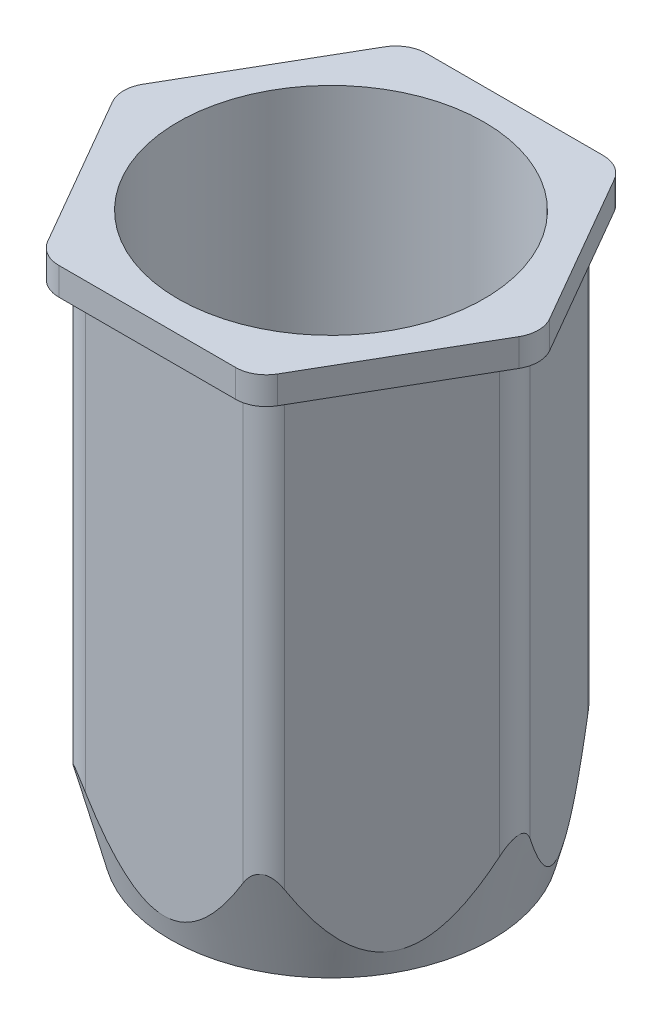
from build123d import *

# Parameters (mm, degrees)
BOSS_EXTRUDE1_DEPTH   = 0.9
BOSS_EXTRUDE2_DEPTH   = 17.1
FILLET2_R             = 1
FILLET3_R             = 0.2
SKETCH4_R             = 5
CUT_EXTRUDE1_DEPTH    = 8
M8_TAPPED_HOLE1_D     = 6.8
M8_TAPPED_HOLE1_DEPTH = 22.25
M8_TAPPED_HOLE1_TIP   = 2.042926105
CHAMFER1_SIZE         = 0.5


with BuildPart() as part:
    # Sketch1 → Boss-Extrude1 (new body)
    with BuildSketch(Plane(origin=(0, 0, 0), x_dir=(1, 0, 0), z_dir=(0, 1, 0))):
        Polygon((6.92820323, 0), (3.464101615, 6), (-3.464101615, 6), (-6.92820323, 0), (-3.464101615, -6), (3.464101615, -6), align=None)
    extrude(amount=-BOSS_EXTRUDE1_DEPTH)

    # Sketch2 → Boss-Extrude2 (add)
    with BuildSketch(Plane.XZ.offset(0.9)):
        Polygon((-6.293117934, 0), (-3.146558967, -5.45), (3.146558967, -5.45), (6.293117934, 0), (3.146558967, 5.45), (-3.146558967, 5.45), align=None)
    extrude(amount=BOSS_EXTRUDE2_DEPTH)

    # Sketch3 → Cut-Revolve1 (revolve, cut)
    with BuildSketch(Plane.XY, mode=Mode.PRIVATE) as cut_revolve1_sk:
        Polygon((-6.293117934, -18), (-5.25, -18), (-6.293117934, -14), align=None)
    revolve(cut_revolve1_sk.sketch.rotate(Axis((0, 0, 0), (0, -1, 0)), 270), axis=Axis((0, 0, 0), (0, -1, 0)), mode=Mode.SUBTRACT)

    # Fillet2
    fillet2_edges = [part.edges().sort_by_distance(p)[0] for p in [
        (-6.92820323, -0.45, 0),
        (-6.293117934, -7.45, 0),
        (-3.146558967, -7.45, -5.45),
        (-3.464101615, -0.45, -6),
        (3.146558967, -7.45, -5.45),
        (3.464101615, -0.45, -6),
        (6.293117934, -7.45, 0),
        (6.92820323, -0.45, 0),
        (3.146558967, -7.45, 5.45),
        (3.464101615, -0.45, 6),
        (-3.146558967, -7.45, 5.45),
        (-3.464101615, -0.45, 6),
    ]]
    fillet(fillet2_edges, radius=FILLET2_R)

    # Fillet3
    fillet3_edges = [part.edges().sort_by_distance(p)[0] for p in [
        (-3.069208698, -0.9, -5.316025404),
        (3.069208698, -0.9, -5.316025404),
        (6.138417396, -0.9, 0),
        (3.069208698, -0.9, 5.316025404),
        (-3.069208698, -0.9, 5.316025404),
        (-6.138417396, -0.9, 0),
        (0, -0.9, -5.45),
        (-4.719838451, -0.9, -2.725),
        (-4.719838451, -0.9, 2.725),
        (0, -0.9, 5.45),
        (4.719838451, -0.9, 2.725),
        (4.719838451, -0.9, -2.725),
    ]]
    fillet(fillet3_edges, radius=FILLET3_R)

    # Sketch4 → Cut-Extrude1 (cut)
    with BuildSketch(Plane(origin=(0, 0, 0), x_dir=(1, 0, 0), z_dir=(0, 1, 0))):
        with Locations(Location((0, 0, 0), (0, 0, 270))):
            Circle(SKETCH4_R)
    extrude(amount=-CUT_EXTRUDE1_DEPTH, mode=Mode.SUBTRACT)

    # M8 Tapped Hole1
    with Locations(Plane(origin=(0, -8, 0), x_dir=(1, 0, 0), z_dir=(0, 1, 0))):
        with Locations((0, 0)):
            Hole(M8_TAPPED_HOLE1_D / 2, depth=M8_TAPPED_HOLE1_DEPTH)
            with Locations((0, 0, -(M8_TAPPED_HOLE1_DEPTH + M8_TAPPED_HOLE1_TIP / 2))):  # 118° drill point
                Cone(0, M8_TAPPED_HOLE1_D / 2, M8_TAPPED_HOLE1_TIP, mode=Mode.SUBTRACT)

    # Chamfer1
    chamfer1_edges = [part.edges().sort_by_distance(p)[0] for p in [
        (3.4, -18, 0),
        (3.4, -8, 0),
    ]]
    chamfer(chamfer1_edges, length=CHAMFER1_SIZE)


solid = part.part
